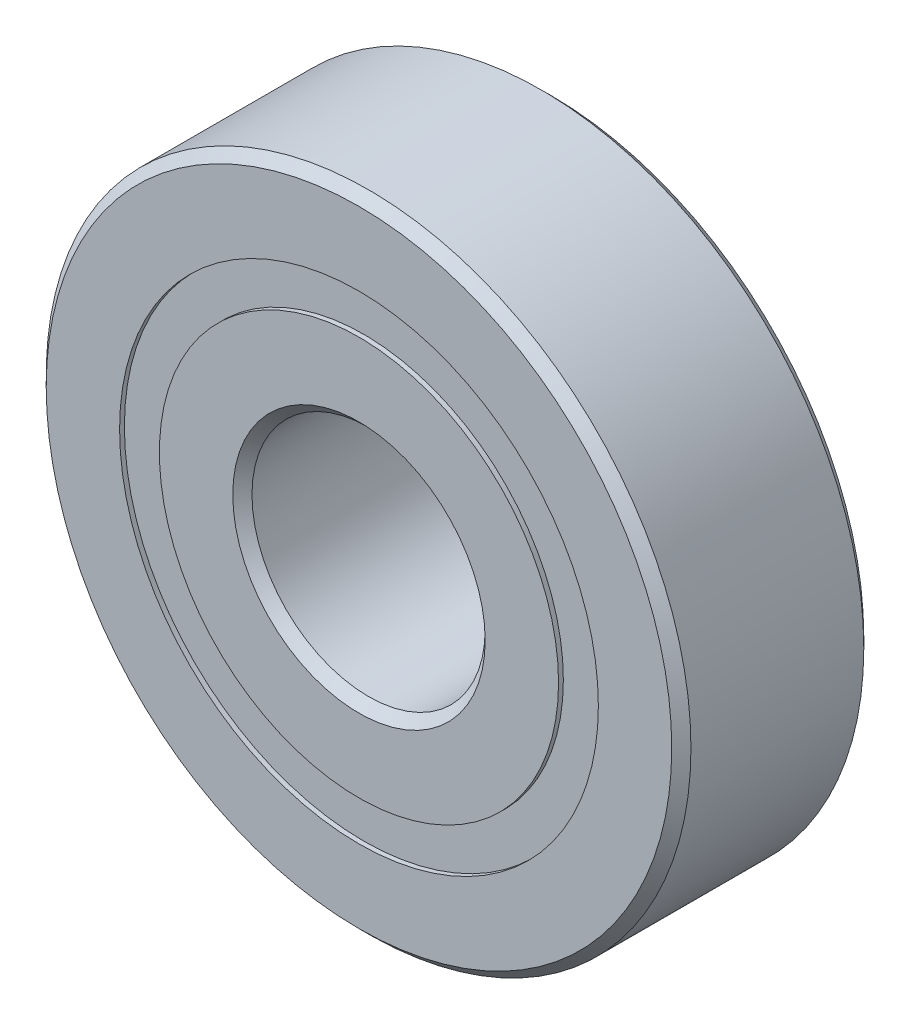
from build123d import *

# Parameters (mm, degrees)
CIRPATTERN1_COUNT = 12


with BuildPart() as part:
    # Sketch6 → Revolve1 (revolve)
    with BuildSketch(Plane(origin=(0, 0, 0), x_dir=(0, 0, -1), z_dir=(1, 0, 0)), mode=Mode.PRIVATE) as revolve1_sk:
        with BuildLine():
            Line((-7, 22.800000000000008), (-7.000000000000001, 17.450549450549456))
            Line((-7.000000000000001, 17.450549450549456), (-3.111111111111111, 17.450549450549456))
            ThreePointArc((-3.111111111111111, 17.450549450549456), (2.1e-16, 19.432652917812746), (3.111111111111111, 17.450549450549456))
            Line((3.111111111111111, 17.450549450549456), (7.000000000000001, 17.450549450549456))
            Line((7.000000000000001, 17.450549450549456), (7, 22.800000000000008))
            Line((7, 22.800000000000008), (6.299999999999993, 23.500000000000007))
            Line((6.299999999999993, 23.500000000000007), (-6.299999999999993, 23.500000000000014))
            Line((-6.299999999999993, 23.500000000000014), (-7, 22.800000000000008))
        make_face()
        with BuildLine():
            Line((-7.000000000000001, 9.200000000000006), (-7.000000000000001, 14.54945054945056))
            Line((-7.000000000000001, 14.54945054945056), (-3.1111111111111116, 14.54945054945056))
            ThreePointArc((-3.1111111111111116, 14.54945054945056), (-5.5e-16, 12.567347082187267), (3.1111111111111107, 14.54945054945056))
            Line((3.1111111111111107, 14.54945054945056), (7.000000000000001, 14.54945054945056))
            Line((7.000000000000001, 14.54945054945056), (7.000000000000001, 9.200000000000006))
            Line((7.000000000000001, 9.200000000000006), (6.3, 8.500000000000007))
            Line((6.3, 8.500000000000007), (-6.3, 8.500000000000007))
            Line((-6.3, 8.500000000000007), (-7.000000000000001, 9.200000000000006))
        make_face()
    revolve(revolve1_sk.sketch.rotate(Axis((0, 0, 7.000000000000001), (0, 0, -1)), 90), axis=Axis((0, 0, 7.000000000000001), (0, 0, -1)))



with BuildPart() as body_2:
    # Sketch4 → Revolve2 (revolve)
    with BuildSketch(Plane(origin=(0, 0, 0), x_dir=(0, 0, -1), z_dir=(1, 0, 0))):
        with BuildLine():
            Line((-3.4326529178127396, 16.000000000000007), (3.4326529178127405, 16.000000000000007))
            ThreePointArc((3.4326529178127405, 16.000000000000007), (2.1e-16, 19.432652917812746), (-3.4326529178127396, 16.000000000000007))
        make_face()
    revolve(axis=Axis((0, 16.000000000000007, 3.4326529178127396), (0, 0, -1)))


with BuildPart() as cirpattern1_1:
    # CirPattern1: pattern copy
    add(body_2.part.rotate(Axis((1.5e-16, -2.3e-16, 0), (0, 0, 1)), 1 * 360 / CIRPATTERN1_COUNT))


with BuildPart() as cirpattern1_2:
    # CirPattern1: pattern copy
    add(body_2.part.rotate(Axis((1.5e-16, -2.3e-16, 0), (0, 0, 1)), 2 * 360 / CIRPATTERN1_COUNT))


with BuildPart() as cirpattern1_3:
    # CirPattern1: pattern copy
    add(body_2.part.rotate(Axis((1.5e-16, -2.3e-16, 0), (0, 0, 1)), 3 * 360 / CIRPATTERN1_COUNT))


with BuildPart() as cirpattern1_4:
    # CirPattern1: pattern copy
    add(body_2.part.rotate(Axis((1.5e-16, -2.3e-16, 0), (0, 0, 1)), 4 * 360 / CIRPATTERN1_COUNT))


with BuildPart() as cirpattern1_5:
    # CirPattern1: pattern copy
    add(body_2.part.rotate(Axis((1.5e-16, -2.3e-16, 0), (0, 0, 1)), 5 * 360 / CIRPATTERN1_COUNT))


with BuildPart() as cirpattern1_6:
    # CirPattern1: pattern copy
    add(body_2.part.rotate(Axis((1.5e-16, -2.3e-16, 0), (0, 0, 1)), 6 * 360 / CIRPATTERN1_COUNT))


with BuildPart() as cirpattern1_7:
    # CirPattern1: pattern copy
    add(body_2.part.rotate(Axis((1.5e-16, -2.3e-16, 0), (0, 0, 1)), 7 * 360 / CIRPATTERN1_COUNT))


with BuildPart() as cirpattern1_8:
    # CirPattern1: pattern copy
    add(body_2.part.rotate(Axis((1.5e-16, -2.3e-16, 0), (0, 0, 1)), 8 * 360 / CIRPATTERN1_COUNT))


with BuildPart() as cirpattern1_9:
    # CirPattern1: pattern copy
    add(body_2.part.rotate(Axis((1.5e-16, -2.3e-16, 0), (0, 0, 1)), 9 * 360 / CIRPATTERN1_COUNT))


with BuildPart() as cirpattern1_10:
    # CirPattern1: pattern copy
    add(body_2.part.rotate(Axis((1.5e-16, -2.3e-16, 0), (0, 0, 1)), 10 * 360 / CIRPATTERN1_COUNT))


with BuildPart() as cirpattern1_11:
    # CirPattern1: pattern copy
    add(body_2.part.rotate(Axis((1.5e-16, -2.3e-16, 0), (0, 0, 1)), 11 * 360 / CIRPATTERN1_COUNT))


with BuildPart() as part_1:
    add(part.part)

    add(body_2.part)  # Revolve3 merges body 2

    add(cirpattern1_1.part)  # Revolve3 merges CirPattern1_1

    add(cirpattern1_2.part)  # Revolve3 merges CirPattern1_2

    add(cirpattern1_3.part)  # Revolve3 merges CirPattern1_3

    add(cirpattern1_4.part)  # Revolve3 merges CirPattern1_4

    add(cirpattern1_5.part)  # Revolve3 merges CirPattern1_5

    add(cirpattern1_6.part)  # Revolve3 merges CirPattern1_6

    add(cirpattern1_7.part)  # Revolve3 merges CirPattern1_7

    add(cirpattern1_8.part)  # Revolve3 merges CirPattern1_8

    add(cirpattern1_9.part)  # Revolve3 merges CirPattern1_9

    add(cirpattern1_10.part)  # Revolve3 merges CirPattern1_10

    add(cirpattern1_11.part)  # Revolve3 merges CirPattern1_11
    # Sketch5 → Revolve3 (revolve)
    with BuildSketch(Plane(origin=(0, 0, 0), x_dir=(0, 0, -1), z_dir=(1, 0, 0)), mode=Mode.PRIVATE) as revolve3_sk:
        Polygon((-6.649999999999992, 17.450549450549456), (-3.432652917812739, 17.450549450549456), (-3.4326529178127387, 14.54945054945056), (-6.649999999999992, 14.54945054945056), align=None)
        Polygon((6.649999999999994, 17.450549450549456), (3.432652917812741, 17.450549450549456), (3.4326529178127414, 14.54945054945056), (6.649999999999994, 14.54945054945056), align=None)
    revolve(revolve3_sk.sketch.rotate(Axis((0, 0, 7.000000000000001), (0, 0, -1)), 90), axis=Axis((0, 0, 7.000000000000001), (0, 0, -1)))


solid = part_1.part
